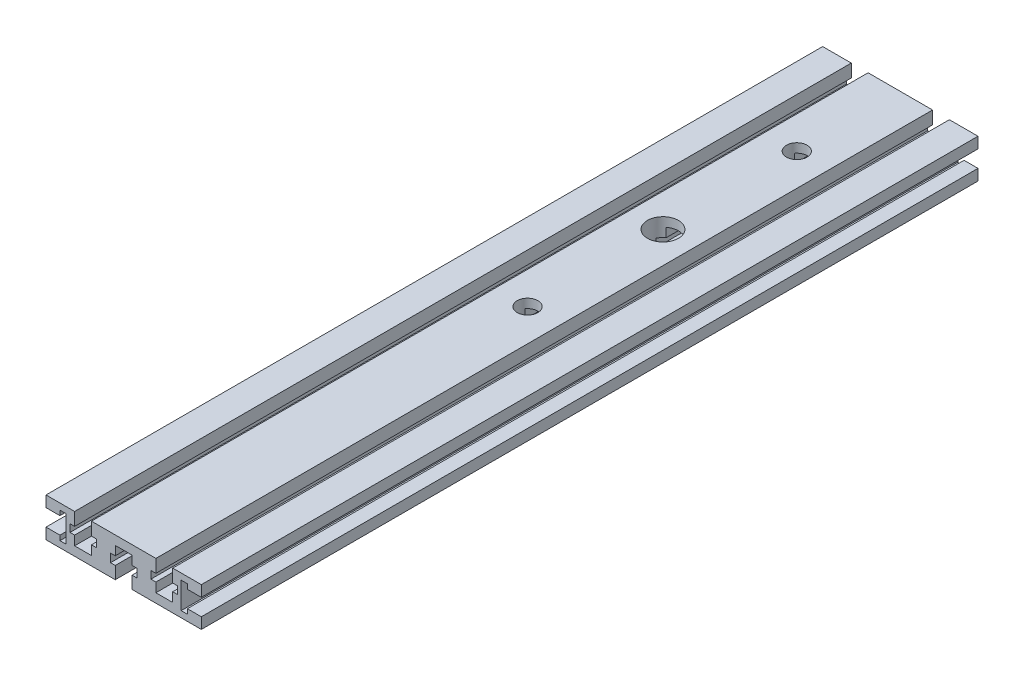
from build123d import *

# Parameters (mm, degrees)
EXTRUDE_1_DEPTH         = 300
HOLE_WIZARD_12_0_12_1_D = 12
HOLE_WIZARD_8_0_8_1_D   = 8
HOLE_WIZARD_6_0_6_1_D   = 6


with BuildPart() as part:
    # 草图1 → 凸台-拉伸1 (new body)
    with BuildSketch(Plane.XY):
        Polygon((0, 0), (26.75, 0), (26.75, 4.796419132), (24.926505169, 4.796419132), (24.926505169, 8.023402897), (26.75, 8.023402897), (26.75, 11.5), (30, 11.5), (33.25, 11.5), (33.25, 8.023402897), (35.073494831, 8.023402897), (35.073494831, 4.796419132), (33.25, 4.796419132), (33.25, 0), (60, 0), (60, 4.25), (54.613325713, 4.25), (54.613325713, 2.4), (52.2, 2.4), (52.2, 12.6), (54.613325713, 12.6), (54.613325713, 10.75), (60, 10.75), (60, 15), (48.947608979, 15), (48.947608979, 10.003848618), (50.733802833, 10.003848618), (50.733802833, 7.094693738), (48.947608979, 7.094693738), (48.947608979, 3.5), (42.447608979, 3.5), (42.447608979, 7.094693738), (40.533802833, 7.094693738), (40.533802833, 10.003848618), (42.447608979, 10.003848618), (42.447608979, 15), (30, 15), (17.552391021, 15), (17.552391021, 10.003848618), (19.466197167, 10.003848618), (19.466197167, 7.094693738), (17.552391021, 7.094693738), (17.552391021, 3.5), (11.052391021, 3.5), (11.052391021, 7.094693738), (9.266197167, 7.094693738), (9.266197167, 10.003848618), (11.052391021, 10.003848618), (11.052391021, 15), (0, 15), (0, 10.75), (5.386674287, 10.75), (5.386674287, 12.6), (7.8, 12.6), (7.8, 2.4), (5.386674287, 2.4), (5.386674287, 4.25), (0, 4.25), align=None)
    extrude(amount=EXTRUDE_1_DEPTH)

    # Ø12.0 (12) 直径孔1 (through all)
    with Locations(Plane(origin=(0, 15, 0), x_dir=(1, 0, 0), z_dir=(0, 1, 0))):
        with Locations((30.31545922, -92)):
            Hole(HOLE_WIZARD_12_0_12_1_D / 2)

    # Ø8.0 (8) 直径孔1 (through all)
    with Locations(Plane(origin=(0, 15, 0), x_dir=(1, 0, 0), z_dir=(0, 1, 0))):
        with Locations((30, -40), (30, -144)):
            Hole(HOLE_WIZARD_8_0_8_1_D / 2)

    # Ø6.0 (6) 直径孔1 (through all)
    with Locations(Plane(origin=(0, 3.5, 0), x_dir=(1, 0, 0), z_dir=(0, 1, 0))):
        with Locations((45.697608979, -7.5)):
            Hole(HOLE_WIZARD_6_0_6_1_D / 2)


solid = part.part
